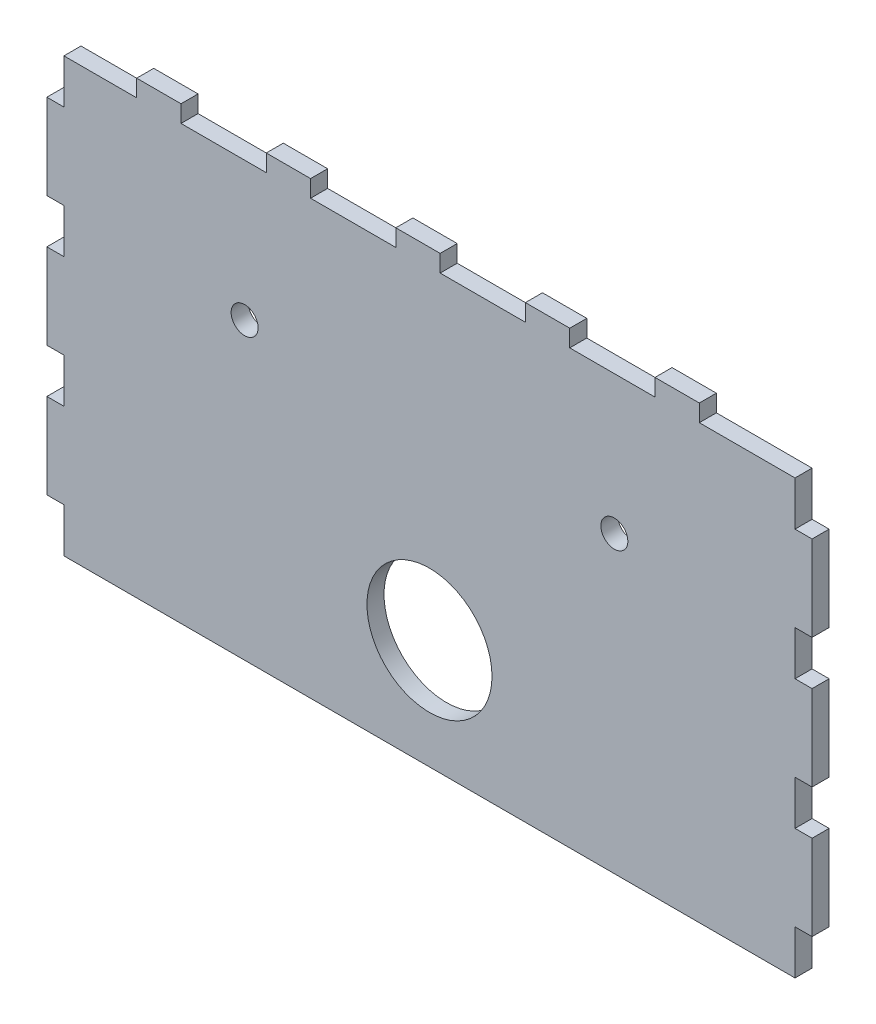
from build123d import *

# Parameters (mm, degrees)
SKETCH1_W               = 134.64
SKETCH1_H               = 76.2
BOSS_EXTRUDE1_DEPTH     = 3
SKETCH2_W               = 3
SKETCH2_H               = 7.8
CUT_EXTRUDE1_DEPTH      = 78.411836304
LPATTERN1_COUNT         = 4
LPATTERN1_PITCH         = 22.8
MIRROR4_COPY_1_SKETCH_W = 3
MIRROR4_COPY_1_SKETCH_H = 7.8
MIRROR4_COPY_1_DEPTH    = 78.411836304
MIRROR4_COPY_2_SKETCH_W = 3
MIRROR4_COPY_2_SKETCH_H = 7.8
MIRROR4_COPY_2_DEPTH    = 78.411836304
MIRROR4_COPY_3_SKETCH_W = 3
MIRROR4_COPY_3_SKETCH_H = 7.8
MIRROR4_COPY_3_DEPTH    = 78.411836304
SKETCH3_W               = 7.8
SKETCH3_H               = 3
BOSS_EXTRUDE2_DEPTH     = 3
LPATTERN2_COUNT         = 5
LPATTERN2_PITCH         = 22.8
SKETCH4_R               = 11
CUT_EXTRUDE2_DEPTH      = 79.931567829
SKETCH5_R               = 2.3749
CUT_EXTRUDE3_DEPTH      = 79.931567829


with BuildPart() as part:
    # Sketch1 → Boss-Extrude1 (new body)
    with BuildSketch(Plane.XY):
        Rectangle(SKETCH1_W, SKETCH1_H)
    extrude(amount=BOSS_EXTRUDE1_DEPTH)

    # Sketch2 → Cut-Extrude1 (cut, through all)
    with BuildSketch(Plane.XY.offset(3)):
        with Locations((-65.82, 34.2)):
            Rectangle(SKETCH2_W, SKETCH2_H)
    cut_extrude1 = extrude(amount=-CUT_EXTRUDE1_DEPTH, mode=Mode.SUBTRACT)

    # LPattern1: Cut-Extrude1 ×4
    with Locations(*[(0, -i * LPATTERN1_PITCH, 0) for i in range(1, LPATTERN1_COUNT)]):
        add(cut_extrude1, mode=Mode.SUBTRACT)

    # Mirror4: Cut-Extrude1 across plane
    add(cut_extrude1.mirror(Plane(origin=(0, 0, 0), x_dir=(0, 0, 1), z_dir=(1, 0, 0))), mode=Mode.SUBTRACT)

    # Mirror4 copy 1 sketch → Mirror4 copy 1 (cut, through all)
    with BuildSketch(Plane(origin=(0, -22.8, 3), x_dir=(-1, 0, 0), z_dir=(0, 0, 1))):
        with Locations((-65.82, -34.2)):
            Rectangle(MIRROR4_COPY_1_SKETCH_W, MIRROR4_COPY_1_SKETCH_H)
    extrude(amount=-MIRROR4_COPY_1_DEPTH, mode=Mode.SUBTRACT)

    # Mirror4 copy 2 sketch → Mirror4 copy 2 (cut, through all)
    with BuildSketch(Plane(origin=(0, -45.6, 3), x_dir=(-1, 0, 0), z_dir=(0, 0, 1))):
        with Locations((-65.82, -34.2)):
            Rectangle(MIRROR4_COPY_2_SKETCH_W, MIRROR4_COPY_2_SKETCH_H)
    extrude(amount=-MIRROR4_COPY_2_DEPTH, mode=Mode.SUBTRACT)

    # Mirror4 copy 3 sketch → Mirror4 copy 3 (cut, through all)
    with BuildSketch(Plane(origin=(0, -68.4, 3), x_dir=(-1, 0, 0), z_dir=(0, 0, 1))):
        with Locations((-65.82, -34.2)):
            Rectangle(MIRROR4_COPY_3_SKETCH_W, MIRROR4_COPY_3_SKETCH_H)
    extrude(amount=-MIRROR4_COPY_3_DEPTH, mode=Mode.SUBTRACT)

    # Sketch3 → Boss-Extrude2 (add)
    with BuildSketch(Plane(origin=(0, 38.1, 0), x_dir=(1, 0, 0), z_dir=(0, 1, 0))):
        with Locations((-47.62, -1.5)):
            Rectangle(SKETCH3_W, SKETCH3_H)
    boss_extrude2 = extrude(amount=BOSS_EXTRUDE2_DEPTH)

    # LPattern2: Boss-Extrude2 ×5
    with Locations(*[(i * LPATTERN2_PITCH, 0, 0) for i in range(1, LPATTERN2_COUNT)]):
        add(boss_extrude2)

    # Sketch4 → Cut-Extrude2 (cut, through all)
    with BuildSketch(Plane.XY.offset(3)):
        with Locations((0, -18.8)):
            Circle(SKETCH4_R)
    extrude(amount=-CUT_EXTRUDE2_DEPTH, mode=Mode.SUBTRACT)

    # Sketch5 → Cut-Extrude3 (cut, through all)
    with BuildSketch(Plane.XY.offset(3)):
        with Locations((32.526911935, 13.726911935)):
            Circle(SKETCH5_R)
        with Locations((-32.526911935, 13.726911935)):
            Circle(SKETCH5_R)
    extrude(amount=-CUT_EXTRUDE3_DEPTH, mode=Mode.SUBTRACT)


solid = part.part
